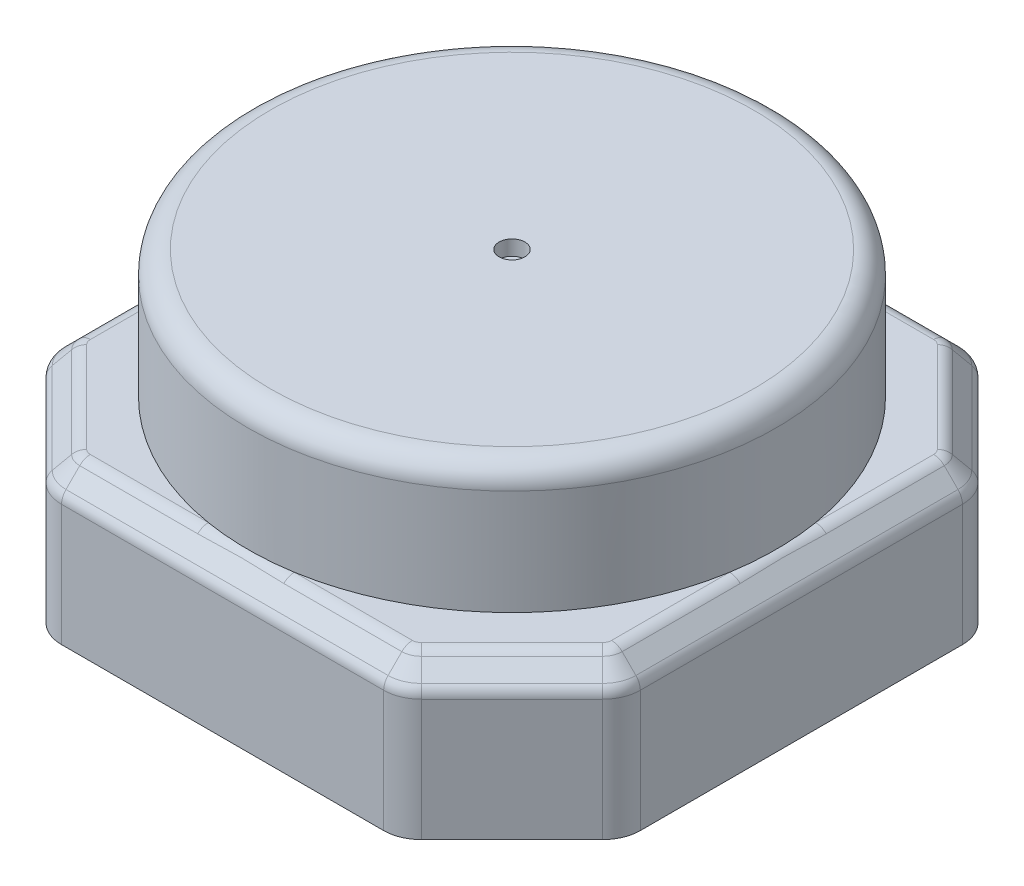
from build123d import *

# Parameters (mm, degrees)
SKETCH1_W           = 77
SKETCH1_H           = 77
BOSS_EXTRUDE2_DEPTH = 20
CHAMFER1_SIZE       = 15
FILLET1_R           = 5
CHAMFER2_SIZE       = 3
FILLET2_R           = 2
SKETCH2_R           = 35.140919579
BOSS_EXTRUDE3_DEPTH = 17
FILLET3_R           = 3
SKETCH3_R           = 1.716609436
CUT_EXTRUDE1_DEPTH  = 2
FILLET4_R           = 2


with BuildPart() as part:
    # Sketch1 → Boss-Extrude2 (new body)
    with BuildSketch(Plane(origin=(0, 0, 0), x_dir=(1, 0, 0), z_dir=(0, 1, 0))):
        Rectangle(SKETCH1_W, SKETCH1_H)
    extrude(amount=BOSS_EXTRUDE2_DEPTH)

    # Chamfer1
    chamfer1_edges = [part.edges().sort_by_distance(p)[0] for p in [
        (-38.5, 10, -38.5),
        (38.5, 10, -38.5),
        (38.5, 10, 38.5),
        (-38.5, 10, 38.5),
    ]]
    chamfer(chamfer1_edges, length=CHAMFER1_SIZE)

    # Fillet1
    fillet1_edges = [part.edges().sort_by_distance(p)[0] for p in [
        (-38.5, 10, 23.5),
        (-38.5, 10, -23.5),
        (23.5, 10, -38.5),
        (-23.5, 10, -38.5),
        (38.5, 10, 23.5),
        (38.5, 10, -23.5),
        (23.5, 10, 38.5),
        (-23.5, 10, 38.5),
    ]]
    fillet(fillet1_edges, radius=FILLET1_R)

    # Chamfer2
    chamfer2_edges = [part.edges().sort_by_distance(p)[0] for p in [
        (0, 20, -38.5),
        (31, 20, -31),
        (-31, 20, -31),
        (-38.5, 20, 0),
        (-31, 20, 31),
        (0, 20, 38.5),
        (31, 20, 31),
        (38.5, 20, 0),
        (-23.34234935, 20, 38.119397663),
        (-38.119397663, 20, 23.34234935),
        (-38.119397663, 20, -23.34234935),
        (-23.34234935, 20, -38.119397663),
        (23.34234935, 20, 38.119397663),
        (38.119397663, 20, 23.34234935),
        (38.119397663, 20, -23.34234935),
        (23.34234935, 20, -38.119397663),
    ]]
    chamfer(chamfer2_edges, length=CHAMFER2_SIZE)

    # Fillet2
    fillet2_edges = [part.edges().sort_by_distance(p)[0] for p in [
        (23.34234935, 17, -38.119397663),
        (-38.5, 17, 0),
        (31, 17, -31),
        (-38.119397663, 17, 23.34234935),
        (38.119397663, 17, -23.34234935),
        (-31, 17, 31),
        (38.5, 17, 0),
        (-23.34234935, 17, 38.119397663),
        (38.119397663, 17, 23.34234935),
        (0, 17, 38.5),
        (23.34234935, 17, 38.119397663),
        (31, 17, 31),
        (-23.34234935, 17, -38.119397663),
        (-31, 17, -31),
        (0, 17, -38.5),
        (-38.119397663, 17, -23.34234935),
    ]]
    fillet(fillet2_edges, radius=FILLET2_R)

    # Sketch2 → Boss-Extrude3 (add)
    with BuildSketch(Plane(origin=(0, 20, 0), x_dir=(1, 0, 0), z_dir=(0, 1, 0))):
        with Locations(Location((0, 0, 0), (0, 0, 270))):
            Circle(SKETCH2_R)
    extrude(amount=BOSS_EXTRUDE3_DEPTH)

    # Fillet3
    fillet3_edges = [part.edges().sort_by_distance(p)[0] for p in [
        (0, 37, -35.140919579),
    ]]
    fillet(fillet3_edges, radius=FILLET3_R)

    # Sketch3 → Cut-Extrude1 (cut)
    with BuildSketch(Plane(origin=(0, 37, 0), x_dir=(1, 0, 0), z_dir=(0, 1, 0))):
        with Locations(Location((0, 0, 0), (0, 0, 270))):
            Circle(SKETCH3_R)
    extrude(amount=-CUT_EXTRUDE1_DEPTH, mode=Mode.SUBTRACT)

    # Fillet4
    fillet4_edges = [part.edges().sort_by_distance(p)[0] for p in [
        (28.878679656, 20, 28.878679656),
        (22.194299053, 20, 35.347759065),
        (0, 20, 35.5),
        (35.347759065, 20, 22.194299053),
        (-22.194299053, 20, 35.347759065),
        (35.5, 20, 0),
        (-28.878679656, 20, 28.878679656),
        (35.347759065, 20, -22.194299053),
        (-35.347759065, 20, 22.194299053),
        (28.878679656, 20, -28.878679656),
        (-35.5, 20, 0),
        (22.194299053, 20, -35.347759065),
        (-35.347759065, 20, -22.194299053),
        (0, 20, -35.5),
        (-28.878679656, 20, -28.878679656),
        (-22.194299053, 20, -35.347759065),
    ]]
    fillet(fillet4_edges, radius=FILLET4_R)


solid = part.part
